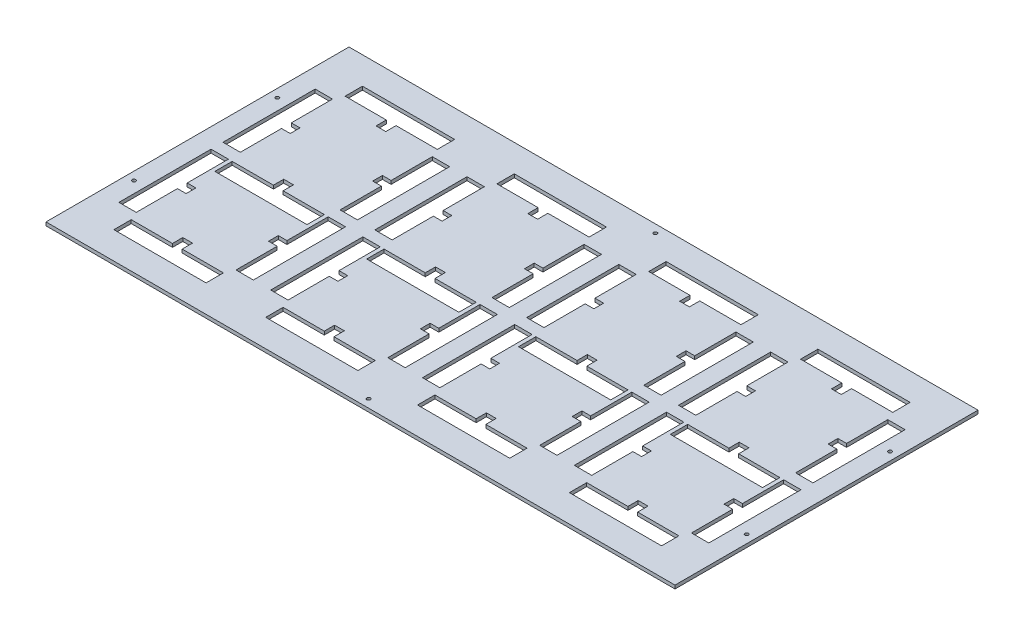
from build123d import *

# Parameters (mm, degrees)
SKETCH1_W           = 580
SKETCH1_H           = 279.4
SKETCH1_R           = 1.65
BOSS_EXTRUDE1_DEPTH = 3.175
CUT_EXTRUDE1_DEPTH  = 3.175


with BuildPart() as part:
    # Sketch1 → Boss-Extrude1 (new body)
    with BuildSketch(Plane(origin=(0, 0, 0), x_dir=(1, 0, 0), z_dir=(0, 1, 0))):
        Rectangle(SKETCH1_W, SKETCH1_H)
        with Locations(Location((-282.5, 66.1, 0), (0, 0, 270))):
            Circle(SKETCH1_R, mode=Mode.SUBTRACT)
        with Locations(Location((-282.5, -66.1, 0), (0, 0, 90))):
            Circle(SKETCH1_R, mode=Mode.SUBTRACT)
        with Locations(Location((282.5, -66.1, 0), (0, 0, 270))):
            Circle(SKETCH1_R, mode=Mode.SUBTRACT)
        with Locations(Location((282.5, 66.1, 0), (0, 0, 90))):
            Circle(SKETCH1_R, mode=Mode.SUBTRACT)
        with Locations(Location((0, 132.2, 0), (0, 0, 270))):
            Circle(SKETCH1_R, mode=Mode.SUBTRACT)
        with Locations(Location((0, -132.2, 0), (0, 0, 270))):
            Circle(SKETCH1_R, mode=Mode.SUBTRACT)
    extrude(amount=BOSS_EXTRUDE1_DEPTH)

    # Sketch2 → Cut-Extrude1 (cut)
    with BuildSketch(Plane(origin=(0, 3.175, 0), x_dir=(1, 0, 0), z_dir=(0, 1, 0))):
        Polygon((-248, 52.5), (-256, 52.5), (-256, 90.5), (-272, 90.5), (-272, 5.5), (-256, 5.5), (-256, 43.5), (-248, 43.5), align=None)
        Polygon((-164, 43.5), (-164, 5.5), (-148, 5.5), (-148, 90.5), (-164, 90.5), (-164, 52.5), (-172, 52.5), (-172, 43.5), align=None)
        Polygon((-172, -52.5), (-164, -52.5), (-164, -90.5), (-148, -90.5), (-148, -5.5), (-164, -5.5), (-164, -43.5), (-172, -43.5), align=None)
        Polygon((-256, -43.5), (-256, -5.5), (-272, -5.5), (-272, -90.5), (-256, -90.5), (-256, -52.5), (-248, -52.5), (-248, -43.5), align=None)
        Polygon((-214.5, 4), (-205.5, 4), (-205.5, -5.5), (-167.5, -5.5), (-167.5, -21.5), (-252.5, -21.5), (-252.5, -5.5), (-214.5, -5.5), align=None)
        Polygon((-214.5, 98.6), (-214.5, 89.1), (-205.5, 89.1), (-205.5, 98.6), (-167.5, 98.6), (-167.5, 114.6), (-252.5, 114.6), (-252.5, 98.6), align=None)
        Polygon((-214.5, -89.1), (-205.5, -89.1), (-205.5, -98.6), (-167.5, -98.6), (-167.5, -114.6), (-252.5, -114.6), (-252.5, -98.6), (-214.5, -98.6), align=None)
        Polygon((-65.5, -98.6), (-65.5, -89.1), (-74.5, -89.1), (-74.5, -98.6), (-112.5, -98.6), (-112.5, -114.6), (-27.5, -114.6), (-27.5, -98.6), align=None)
        Polygon((-65.5, 89.1), (-74.5, 89.1), (-74.5, 98.6), (-112.5, 98.6), (-112.5, 114.6), (-27.5, 114.6), (-27.5, 98.6), (-65.5, 98.6), align=None)
        Polygon((-65.5, -5.5), (-65.5, 4), (-74.5, 4), (-74.5, -5.5), (-112.5, -5.5), (-112.5, -21.5), (-27.5, -21.5), (-27.5, -5.5), align=None)
        Polygon((-32, -52.5), (-24, -52.5), (-24, -90.5), (-8, -90.5), (-8, -5.5), (-24, -5.5), (-24, -43.5), (-32, -43.5), align=None)
        Polygon((-116, -43.5), (-116, -5.5), (-132, -5.5), (-132, -90.5), (-116, -90.5), (-116, -52.5), (-108, -52.5), (-108, -43.5), align=None)
        Polygon((-108, 52.5), (-116, 52.5), (-116, 90.5), (-132, 90.5), (-132, 5.5), (-116, 5.5), (-116, 43.5), (-108, 43.5), align=None)
        Polygon((-24, 43.5), (-24, 5.5), (-8, 5.5), (-8, 90.5), (-24, 90.5), (-24, 52.5), (-32, 52.5), (-32, 43.5), align=None)
        Polygon((32, 52.5), (24, 52.5), (24, 90.5), (8, 90.5), (8, 5.5), (24, 5.5), (24, 43.5), (32, 43.5), align=None)
        Polygon((116, 43.5), (116, 5.5), (132, 5.5), (132, 90.5), (116, 90.5), (116, 52.5), (108, 52.5), (108, 43.5), align=None)
        Polygon((108, -52.5), (116, -52.5), (116, -90.5), (132, -90.5), (132, -5.5), (116, -5.5), (116, -43.5), (108, -43.5), align=None)
        Polygon((24, -43.5), (24, -5.5), (8, -5.5), (8, -90.5), (24, -90.5), (24, -52.5), (32, -52.5), (32, -43.5), align=None)
        Polygon((65.5, 4), (74.5, 4), (74.5, -5.5), (112.5, -5.5), (112.5, -21.5), (27.5, -21.5), (27.5, -5.5), (65.5, -5.5), align=None)
        Polygon((65.5, 98.6), (65.5, 89.1), (74.5, 89.1), (74.5, 98.6), (112.5, 98.6), (112.5, 114.6), (27.5, 114.6), (27.5, 98.6), align=None)
        Polygon((65.5, -89.1), (74.5, -89.1), (74.5, -98.6), (112.5, -98.6), (112.5, -114.6), (27.5, -114.6), (27.5, -98.6), (65.5, -98.6), align=None)
        Polygon((214.5, -98.6), (214.5, -89.1), (205.5, -89.1), (205.5, -98.6), (167.5, -98.6), (167.5, -114.6), (252.5, -114.6), (252.5, -98.6), align=None)
        Polygon((214.5, 89.1), (205.5, 89.1), (205.5, 98.6), (167.5, 98.6), (167.5, 114.6), (252.5, 114.6), (252.5, 98.6), (214.5, 98.6), align=None)
        Polygon((214.5, -5.5), (214.5, 4), (205.5, 4), (205.5, -5.5), (167.5, -5.5), (167.5, -21.5), (252.5, -21.5), (252.5, -5.5), align=None)
        Polygon((248, -52.5), (256, -52.5), (256, -90.5), (272, -90.5), (272, -5.5), (256, -5.5), (256, -43.5), (248, -43.5), align=None)
        Polygon((164, -43.5), (164, -5.5), (148, -5.5), (148, -90.5), (164, -90.5), (164, -52.5), (172, -52.5), (172, -43.5), align=None)
        Polygon((172, 52.5), (164, 52.5), (164, 90.5), (148, 90.5), (148, 5.5), (164, 5.5), (164, 43.5), (172, 43.5), align=None)
        Polygon((256, 43.5), (256, 5.5), (272, 5.5), (272, 90.5), (256, 90.5), (256, 52.5), (248, 52.5), (248, 43.5), align=None)
    extrude(amount=-CUT_EXTRUDE1_DEPTH, mode=Mode.SUBTRACT)


solid = part.part
